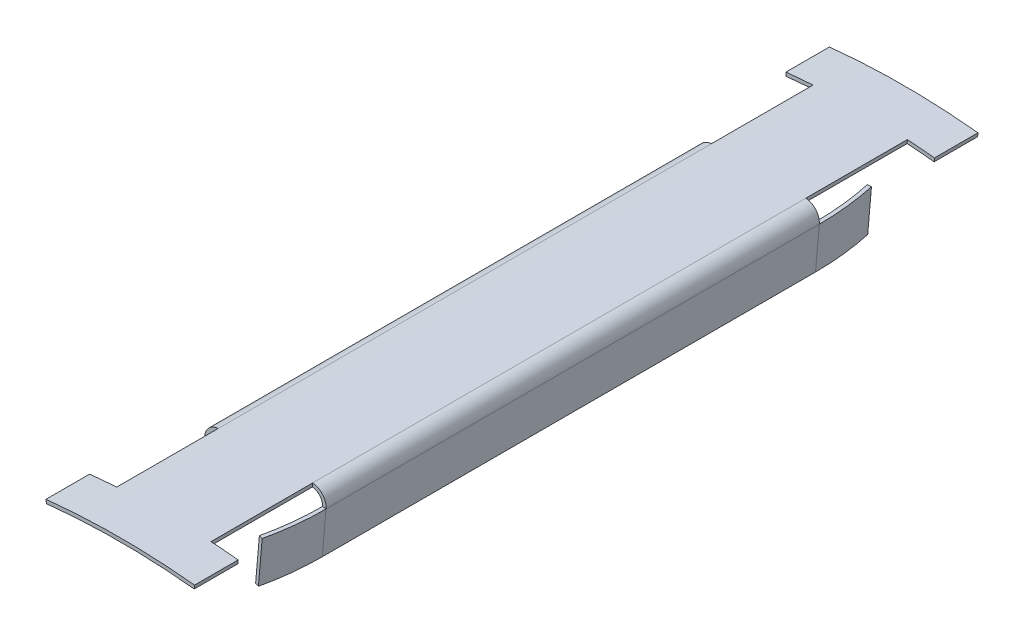
from build123d import *

# Parameters (mm, degrees)
EXTRUSION1_DEPTH = 34
EXTRUSION2_DEPTH = 3
EXTRUSION3_START = 10
EXTRUSION3_DEPTH = 10
EXTRUSION4_DEPTH = 10
EXTRUSION5_START = -3
EXTRUSION5_DEPTH = 3
EXTRUSION6_DEPTH = 3


with BuildPart() as part:
    # Esquisse1 → Extrusion1 (new body)
    with BuildSketch(Plane.XY):
        with BuildLine():
            Line((-3.933519007, 47.82875629), (-3.672032862, 44.839955984))
            Line((-3.672032862, 44.839955984), (-3.921081537, 44.818167048))
            Line((-3.921081537, 44.818167048), (-4.182567681, 47.806967354))
            ThreePointArc((-4.182567681, 47.806967354), (-3.945679792, 48.544855891), (-3.252755753, 48.891917328))
            ThreePointArc((-3.252755753, 48.891917328), (-1.627275473, 48.972971878), (0, 49))
            Line((0, 49), (0, 48.75))
            ThreePointArc((0, 48.75), (-1.618973047, 48.723109776), (-3.236160061, 48.64246877))
            ThreePointArc((-3.236160061, 48.64246877), (-3.75585309, 48.382172692), (-3.933519007, 47.82875629))
        make_face()
    extrusion1 = extrude(amount=EXTRUSION1_DEPTH)

    # Esquisse2 → Extrusion2 (add)
    with BuildSketch(Plane(origin=(-3.921081537, 44.818167048, 0), x_dir=(0.9961946980917463, 0.08715574274764933, 0), z_dir=(0.08715574274764933, -0.9961946980917464, 0))):
        with BuildLine():
            Line((0, 34), (0.25, 34))
            ThreePointArc((0.25, 34), (0.350010978, 35.985052), (0.649031032, 37.95))
            Line((0.649031032, 37.95), (0.404082058, 38))
            ThreePointArc((0.404082058, 38), (0.10127694, 36.01017924), (0, 34))
        make_face()
        with BuildLine():
            Line((0.404082058, -4), (0.649031032, -3.95))
            ThreePointArc((0.649031032, -3.95), (0.350010978, -1.985052), (0.25, 0))
            Line((0.25, 0), (0, 0))
            ThreePointArc((0, 0), (0.10127694, -2.01017924), (0.404082058, -4))
        make_face()
    extrusion2 = extrude(amount=-EXTRUSION2_DEPTH)

    # Esquisse3 → Extrusion3 (add)
    with BuildSketch(Plane(origin=(0, 0, 0), x_dir=(-1, 0, 0), z_dir=(0, 0, -1)).offset(EXTRUSION3_START)):
        with BuildLine():
            Line((3.236160061, 48.64246877), (3.252755753, 48.891917328))
            ThreePointArc((3.252755753, 48.891917328), (1.627275473, 48.972971878), (0, 49))
            Line((0, 49), (0, 48.75))
            ThreePointArc((0, 48.75), (1.618973047, 48.723109776), (3.236160061, 48.64246877))
        make_face()
    extrusion3 = extrude(amount=-EXTRUSION3_DEPTH)

    # Esquisse4 → Extrusion4 (add)
    with BuildSketch(Plane.XY.offset(34)):
        with BuildLine():
            Line((-3.236160061, 48.64246877), (-3.252755753, 48.891917328))
            ThreePointArc((-3.252755753, 48.891917328), (-1.627275473, 48.972971878), (0, 49))
            Line((0, 49), (0, 48.75))
            ThreePointArc((0, 48.75), (-1.618973047, 48.723109776), (-3.236160061, 48.64246877))
        make_face()
    extrusion4 = extrude(amount=EXTRUSION4_DEPTH)

    # Esquisse5 → Extrusion5 (add)
    with BuildSketch(Plane.XY.offset(44).offset(EXTRUSION5_START)):
        with BuildLine():
            Line((-5.1218947, 48.731572873), (-5.095762584, 48.482942399))
            ThreePointArc((-5.095762584, 48.482942399), (-2.551377867, 48.683189819), (0, 48.75))
            Line((0, 48.75), (0, 49))
            ThreePointArc((0, 49), (-2.564461856, 48.932847203), (-5.1218947, 48.731572873))
        make_face()
    extrusion5 = extrude(amount=EXTRUSION5_DEPTH)

    # Esquisse6 → Extrusion6 (add)
    with BuildSketch(Plane(origin=(0, 0, -10), x_dir=(-1, 0, 0), z_dir=(0, 0, -1))):
        with BuildLine():
            Line((0, 49), (0, 48.75))
            ThreePointArc((0, 48.75), (2.551377867, 48.683189819), (5.095762584, 48.482942399))
            Line((5.095762584, 48.482942399), (5.1218947, 48.731572873))
            ThreePointArc((5.1218947, 48.731572873), (2.564461856, 48.932847203), (0, 49))
        make_face()
    extrusion6 = extrude(amount=-EXTRUSION6_DEPTH)

    # Symétrie1: Extrusion1, Extrusion2, Extrusion3, Extrusion4, Extrusion5, Extrusion6 across plane
    add(extrusion1.mirror(Plane(origin=(0, 48.75, 34), x_dir=(0, 0, 1), z_dir=(-1, 0, 0))))
    add(extrusion2.mirror(Plane(origin=(0, 48.75, 34), x_dir=(0, 0, 1), z_dir=(-1, 0, 0))))
    add(extrusion3.mirror(Plane(origin=(0, 48.75, 34), x_dir=(0, 0, 1), z_dir=(-1, 0, 0))))
    add(extrusion4.mirror(Plane(origin=(0, 48.75, 34), x_dir=(0, 0, 1), z_dir=(-1, 0, 0))))
    add(extrusion5.mirror(Plane(origin=(0, 48.75, 34), x_dir=(0, 0, 1), z_dir=(-1, 0, 0))))
    add(extrusion6.mirror(Plane(origin=(0, 48.75, 34), x_dir=(0, 0, 1), z_dir=(-1, 0, 0))))


solid = part.part
